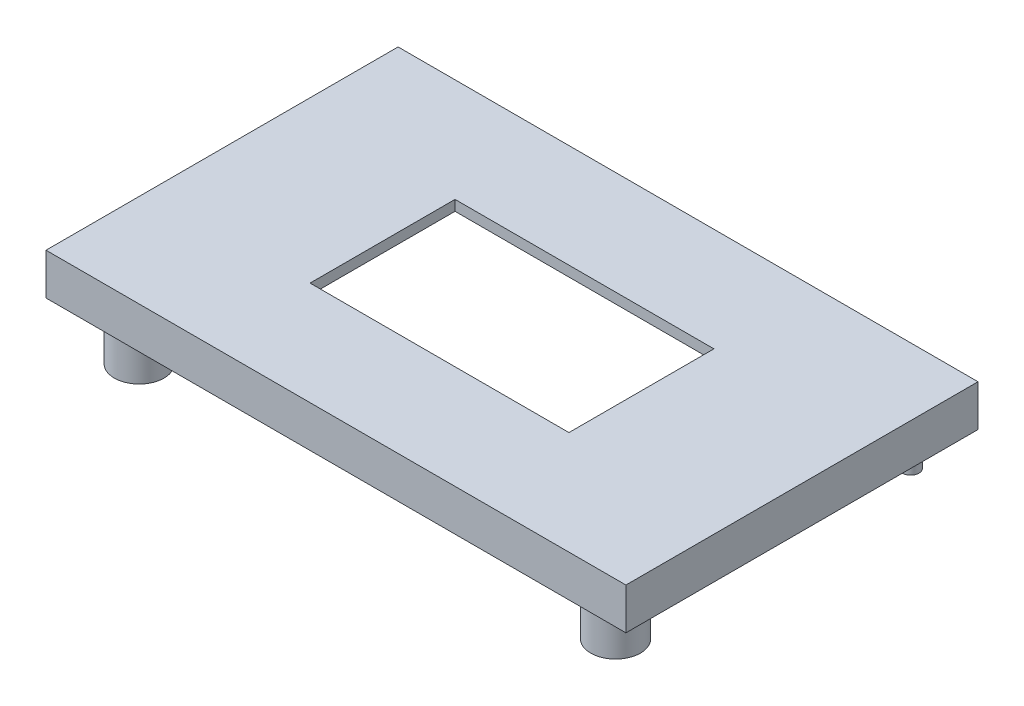
from build123d import *

# Parameters (mm, degrees)
SKETCH_2_W      = 56
SKETCH_2_H      = 32
EXTRUDE_1_DEPTH = 3
SKETCH_3_W      = 56
SKETCH_3_H      = 32
SKETCH_3_W_2    = 25
SKETCH_3_H_2    = 14
EXTRUDE_2_DEPTH = 1
SKETCH_4_R      = 2.4
EXTRUDE_3_DEPTH = 5
SKETCH_6_W      = 56
SKETCH_6_H      = 2
EXTRUDE_4_DEPTH = 4
SKETCH_7_R      = 0.8
EXTRUDE_5_DEPTH = 5


with BuildPart() as part:
    # 草图2 → 凸台-拉伸1 (new body)
    with BuildSketch(Plane(origin=(0, 0, 0), x_dir=(1, 0, 0), z_dir=(0, 1, 0))):
        with Locations((6.832, -6.328)):
            Rectangle(SKETCH_2_W, SKETCH_2_H)
        Polygon((-20.168, -11.589207904), (-20.168, 4.317392289), (-20.168, 8.672), (33.832, 8.672), (33.832, -14.328), (20.832, -14.328), (20.832, -21.328), (-7.168, -21.328), (-7.168, -14.328), (-20.168, -14.328), align=None, mode=Mode.SUBTRACT)
    extrude(amount=EXTRUDE_1_DEPTH)

    # 草图3 → 凸台-拉伸2 (add)
    with BuildSketch(Plane(origin=(0, 3, 0), x_dir=(1, 0, 0), z_dir=(0, 1, 0))):
        with Locations((6.832, -6.328)):
            Rectangle(SKETCH_3_W, SKETCH_3_H)
        with Locations((6.832, -5.328)):
            Rectangle(SKETCH_3_W_2, SKETCH_3_H_2, mode=Mode.SUBTRACT)
    extrude(amount=EXTRUDE_2_DEPTH)

    # 草图4 → 凸台-拉伸3 (add)
    with BuildSketch(Plane(origin=(0, 0, 0), x_dir=(-1, 0, 0), z_dir=(0, -1, 0))):
        with Locations(Location((16.168, -18.328, 0), (0, 0, 270))):
            Circle(SKETCH_4_R)
        with Locations(Location((-29.832, -18.328, 0), (0, 0, 270))):
            Circle(SKETCH_4_R)
    extrude(amount=EXTRUDE_3_DEPTH)

    # 草图6 → 凸台-拉伸4 (add)
    with BuildSketch(Plane(origin=(0, 4, 0), x_dir=(-1, 0, 0), z_dir=(0, -1, 0))):
        with Locations((-6.832, 10.672)):
            Rectangle(SKETCH_6_W, SKETCH_6_H)
    extrude(amount=EXTRUDE_4_DEPTH)

    # 草图7 → 凸台-拉伸5 (add)
    with BuildSketch(Plane(origin=(0, 0, 0), x_dir=(-1, 0, 0), z_dir=(0, -1, 0))):
        with Locations(Location((-29.832, 10.172, 0), (0, 0, 270))):
            Circle(SKETCH_7_R)
        with Locations(Location((16.168, 10.172, 0), (0, 0, 270))):
            Circle(SKETCH_7_R)
    extrude(amount=EXTRUDE_5_DEPTH)


solid = part.part
